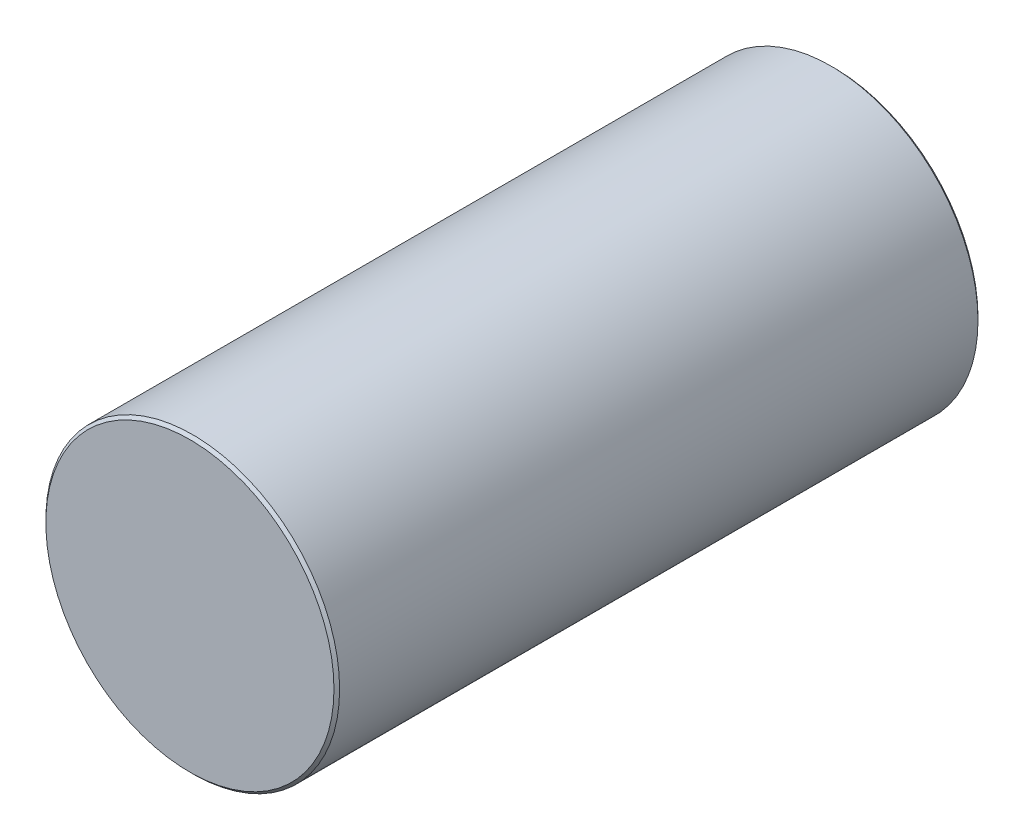
from build123d import *

# Parameters (mm, degrees)
SKETCH2_R           = 2.6
BOSS_EXTRUDE1_DEPTH = 11.4
CHAMFER2_SIZE       = 0.05


with BuildPart() as part:
    # Sketch2 → Boss-Extrude1 (new body)
    with BuildSketch(Plane.XY):
        Circle(SKETCH2_R)
    extrude(amount=BOSS_EXTRUDE1_DEPTH)

    # Chamfer2
    chamfer2_edges = [part.edges().sort_by_distance(p)[0] for p in [
        (-2.6, 0, 0),
        (-2.6, 0, 11.4),
    ]]
    chamfer(chamfer2_edges, length=CHAMFER2_SIZE)


solid = part.part
